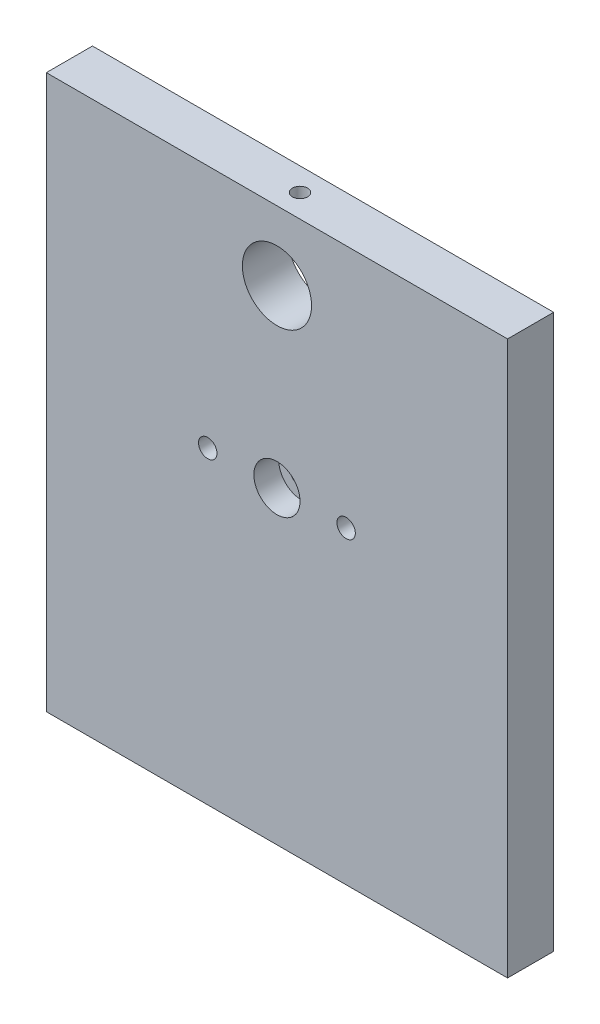
from build123d import *

# Parameters (mm, degrees)
SKIZZE1_W                                            = 100
SKIZZE1_H                                            = 120
AUFSATZ_LINEAR_AUSTRAGEN1_DEPTH                      = 10
F_15_0_15_DURCHMESSER_BOHRUNG1_D                     = 15
M5_GEWINDEBOHRUNG1_D                                 = 4.2
M5_GEWINDEBOHRUNG1_DEPTH                             = 14
M5_GEWINDEBOHRUNG1_TIP                               = 1.2618073
M4_GEWINDEBOHRUNG1_D                                 = 3.3
M4_GEWINDEBOHRUNG1_DEPTH                             = 11.5
M4_GEWINDEBOHRUNG1_TIP                               = 0.991420021
STIRNSENKUNG_F_R_M5_ZYLINDERSCHRAUBE_MIT_D           = 5.5
STIRNSENKUNG_F_R_M5_ZYLINDERSCHRAUBE_MIT_CBORE_D     = 10
STIRNSENKUNG_F_R_M5_ZYLINDERSCHRAUBE_MIT_CBORE_DEPTH = 5.4
F_4_0_4_DURCHMESSER_BOHRUNG2_D                       = 4


with BuildPart() as part:
    # Skizze1 → Aufsatz-Linear austragen1 (new body)
    with BuildSketch(Plane.XY):
        with Locations((0, 60)):
            Rectangle(SKIZZE1_W, SKIZZE1_H)
    extrude(amount=AUFSATZ_LINEAR_AUSTRAGEN1_DEPTH)

    # Ø15.0 (15) Durchmesser Bohrung1 (through all)
    with Locations(Plane.XY.offset(10)):
        with Locations((0, 105)):
            Hole(F_15_0_15_DURCHMESSER_BOHRUNG1_D / 2)

    # M5 Gewindebohrung1
    with Locations(Plane(origin=(0, 0, 0), x_dir=(-1, 0, 0), z_dir=(0, -1, 0))):
        with Locations((0, -5), (35, -5), (-35, -5)):
            Hole(M5_GEWINDEBOHRUNG1_D / 2, depth=M5_GEWINDEBOHRUNG1_DEPTH)
            with Locations((0, 0, -(M5_GEWINDEBOHRUNG1_DEPTH + M5_GEWINDEBOHRUNG1_TIP / 2))):  # 118° drill point
                Cone(0, M5_GEWINDEBOHRUNG1_D / 2, M5_GEWINDEBOHRUNG1_TIP, mode=Mode.SUBTRACT)

    # M4 Gewindebohrung1
    with Locations(Plane(origin=(0, 120, 0), x_dir=(1, 0, 0), z_dir=(0, 1, 0))):
        with Locations((0, -5)):
            Hole(M4_GEWINDEBOHRUNG1_D / 2, depth=M4_GEWINDEBOHRUNG1_DEPTH)
            with Locations((0, 0, -(M4_GEWINDEBOHRUNG1_DEPTH + M4_GEWINDEBOHRUNG1_TIP / 2))):  # 118° drill point
                Cone(0, M4_GEWINDEBOHRUNG1_D / 2, M4_GEWINDEBOHRUNG1_TIP, mode=Mode.SUBTRACT)

    # Stirnsenkung für M5 Zylinderschraube mit Innensechskant2 (through all)
    with Locations(Plane.XY.offset(10)):
        with Locations((0, 67)):
            CounterBoreHole(STIRNSENKUNG_F_R_M5_ZYLINDERSCHRAUBE_MIT_D / 2, STIRNSENKUNG_F_R_M5_ZYLINDERSCHRAUBE_MIT_CBORE_D / 2, STIRNSENKUNG_F_R_M5_ZYLINDERSCHRAUBE_MIT_CBORE_DEPTH)

    # Ø4.0 (4) Durchmesser Bohrung2 (through all)
    with Locations(Plane.XY.offset(10)):
        with Locations((15, 67), (-15, 67)):
            Hole(F_4_0_4_DURCHMESSER_BOHRUNG2_D / 2)


solid = part.part
